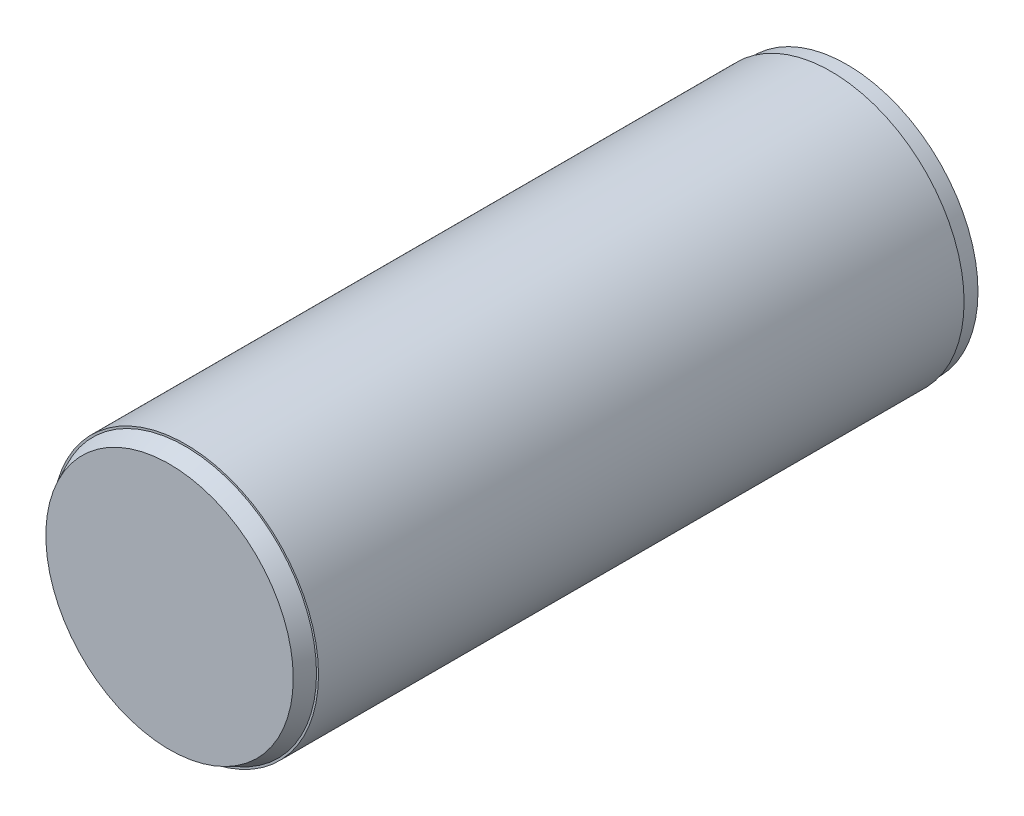
from build123d import *

# Parameters (mm, degrees)
SKETCH1_R           = 5105.4
BOSS_EXTRUDE1_DEPTH = 50.8
SKETCH2_R           = 5105.4
SKETCH2_R_2         = 5092.7
BOSS_EXTRUDE2_DEPTH = 24688.8
SKETCH3_R           = 5105.4
BOSS_EXTRUDE3_DEPTH = 25.4
SKETCH4_R           = 5029.2
BOSS_EXTRUDE4_DEPTH = 609.6
BOSS_EXTRUDE4_TAPER = 25
SKETCH5_R           = 5029.2
SKETCH5_R_2         = 4876.8
BOSS_EXTRUDE5_DEPTH = 609.6


with BuildPart() as part:
    # Sketch1 → Boss-Extrude1 (new body)
    with BuildSketch(Plane.XY):
        Circle(SKETCH1_R)
    extrude(amount=BOSS_EXTRUDE1_DEPTH)

    # Sketch2 → Boss-Extrude2 (add)
    with BuildSketch(Plane.XY.offset(50.8)):
        Circle(SKETCH2_R)
        with Locations(Location((0, 0, 0), (0, 0, 180))):
            Circle(SKETCH2_R_2, mode=Mode.SUBTRACT)
    extrude(amount=BOSS_EXTRUDE2_DEPTH)

    # Sketch3 → Boss-Extrude3 (add)
    with BuildSketch(Plane.XY.offset(24739.6)):
        Circle(SKETCH3_R)
    extrude(amount=BOSS_EXTRUDE3_DEPTH)

    # Sketch4 → Boss-Extrude4 (add)
    with BuildSketch(Plane.XY.offset(24765)):
        Circle(SKETCH4_R)
    extrude(amount=BOSS_EXTRUDE4_DEPTH, taper=BOSS_EXTRUDE4_TAPER)

    # Sketch5 → Boss-Extrude5 (add)
    with BuildSketch(Plane(origin=(0, 0, 0), x_dir=(-1, 0, 0), z_dir=(0, 0, -1))):
        with Locations(Location((0, 0, 0), (0, 0, 180))):
            Circle(SKETCH5_R)
        with Locations(Location((0, 0, 0), (0, 0, 180))):
            Circle(SKETCH5_R_2, mode=Mode.SUBTRACT)
    extrude(amount=BOSS_EXTRUDE5_DEPTH)


solid = part.part
